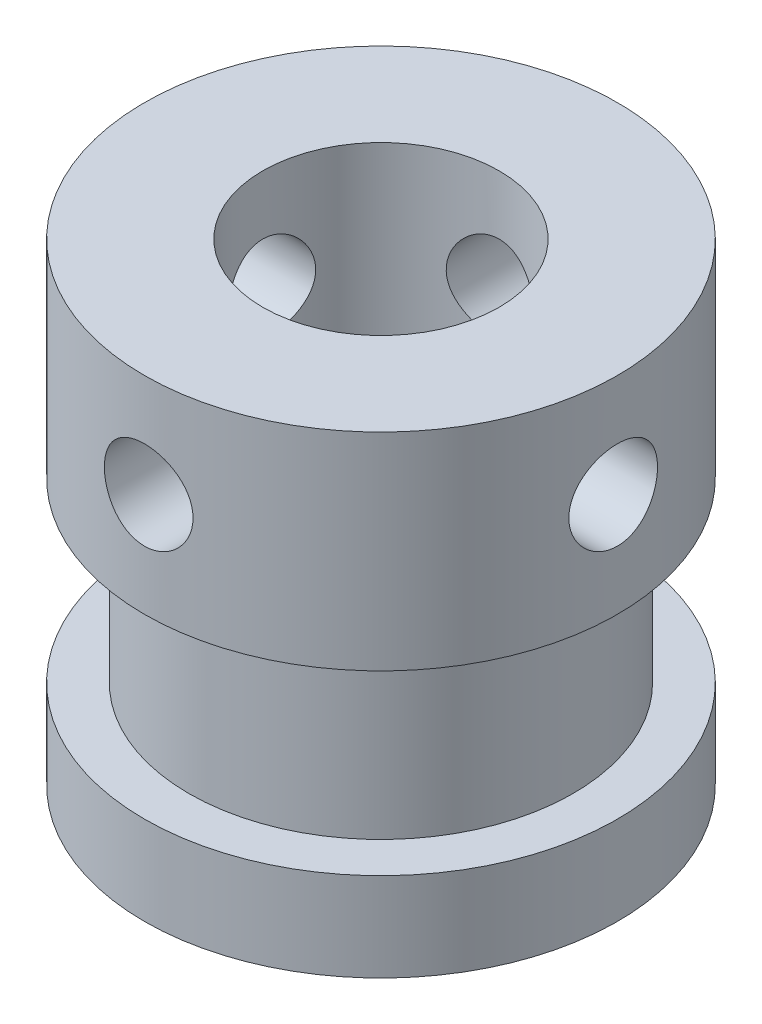
from build123d import *

# Parameters (mm, degrees)
SKETCH_1_R               = 8
EXTRUDE_1_DEPTH          = 16
SKETCH_2_R               = 4
CUT_EXTRUDE_1_DEPTH      = 20.595917942
SKETCH_3_OUTSIDE_W       = 23.542
SKETCH_3_OUTSIDE_H       = 23.542
SKETCH_3_OUTSIDE_R       = 6.5
CUT_EXTRUDE_2_DEPTH      = 6
CUT_EXTRUDE_3_DEPTH      = 20.595917942
CUT_EXTRUDE_3_DEPTH_BACK = 20.595917942
SKETCH_4_R               = 1.5
CUT_EXTRUDE_4_DEPTH      = 20.595918116
CUT_EXTRUDE_4_DEPTH_BACK = 20.595918116
SKETCH_5_R               = 1.5


with BuildPart() as part:
    # 草图1 → 凸台-拉伸1 (new body)
    with BuildSketch(Plane(origin=(0, 0, 0), x_dir=(1, 0, 0), z_dir=(0, 1, 0))):
        with Locations(Location((0, 0, 0), (0, 0, 270))):
            Circle(SKETCH_1_R)
    extrude(amount=EXTRUDE_1_DEPTH)

    # 草图2 → 切除-拉伸1 (cut, through all)
    with BuildSketch(Plane(origin=(0, 16, 0), x_dir=(1, 0, 0), z_dir=(0, 1, 0))):
        with Locations(Location((0, 0, 0), (0, 0, 270))):
            Circle(SKETCH_2_R)
    extrude(amount=-CUT_EXTRUDE_1_DEPTH, mode=Mode.SUBTRACT)

    # 草图3 outside → 切除-拉伸2 (cut)
    with BuildSketch(Plane(origin=(0, 3, 0), x_dir=(1, 0, 0), z_dir=(0, 1, 0))):
        Rectangle(SKETCH_3_OUTSIDE_W, SKETCH_3_OUTSIDE_H)
        with Locations(Location((0, 0, 0), (0, 0, 270))):
            Circle(SKETCH_3_OUTSIDE_R, mode=Mode.SUBTRACT)
    extrude(amount=CUT_EXTRUDE_2_DEPTH, mode=Mode.SUBTRACT)

    # 草图4 → 切除-拉伸3 (cut, two sides: drawn at the far end of the back side and taken through both)
    with BuildSketch(Plane(origin=(0, 0, 0), x_dir=(0, 0, -1), z_dir=(1, 0, 0)).offset(-CUT_EXTRUDE_3_DEPTH_BACK)):
        with Locations((0, 12.5)):
            Circle(SKETCH_4_R)
    extrude(amount=CUT_EXTRUDE_3_DEPTH + CUT_EXTRUDE_3_DEPTH_BACK, mode=Mode.SUBTRACT)

    # 草图5 → 切除-拉伸4 (cut, two sides: drawn at the far end of the back side and taken through both)
    with BuildSketch(Plane.XY.offset(-CUT_EXTRUDE_4_DEPTH_BACK)):
        with Locations((0, 12.5)):
            Circle(SKETCH_5_R)
    extrude(amount=CUT_EXTRUDE_4_DEPTH + CUT_EXTRUDE_4_DEPTH_BACK, mode=Mode.SUBTRACT)


solid = part.part
